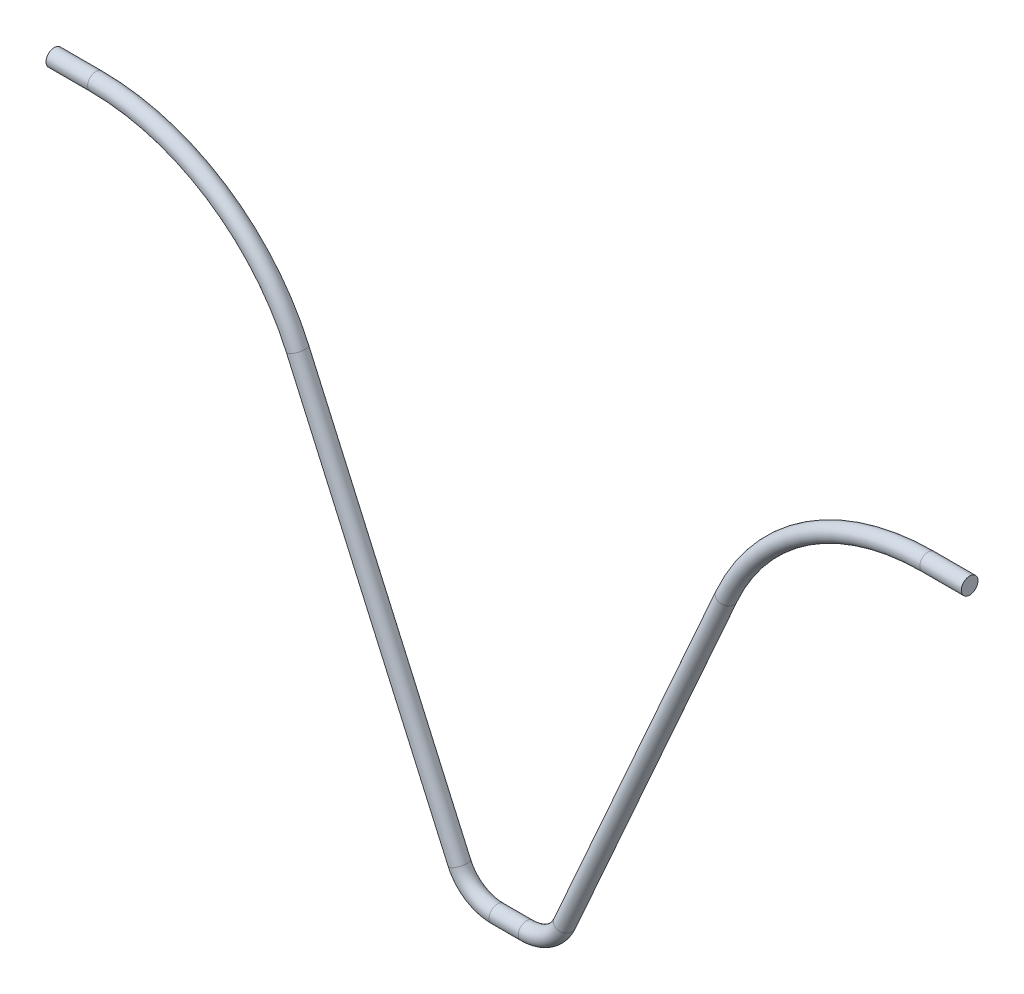
from build123d import *

# Parameters (mm, degrees)
SKETCH2_R = 2


with BuildPart() as part:
    # Sweep1: sweep along a path in Sketch1
    with BuildLine(Plane.XY) as sweep1_path:
        Line((110, 125), (100, 125))
        ThreePointArc((100, 125), (71.097881111, 116.432253912), (51.53440584, 93.497363796))
        Line((51.53440584, 93.497363796), (12.63884007, 5.940246046))
        ThreePointArc((12.63884007, 5.940246046), (8.949883506, 1.615563837), (3.5, 0))
        Line((3.5, 0), (-3.5, 0))
        ThreePointArc((-3.5, 0), (-8.949883506, 1.615563837), (-12.63884007, 5.940246046))
        Line((-12.63884007, 5.940246046), (-51.53440584, 93.497363796))
        ThreePointArc((-51.53440584, 93.497363796), (-71.097881111, 116.432253912), (-100, 125))
        Line((-100, 125), (-110, 125))
    # Sketch2 → Sweep1 (sweep)
    with BuildSketch(Plane(origin=(-110, 0, 0), x_dir=(0, 0, -1), z_dir=(1, 0, 0))):
        with Locations((0, 125)):
            Circle(SKETCH2_R)
    sweep(path=sweep1_path.line)


solid = part.part
